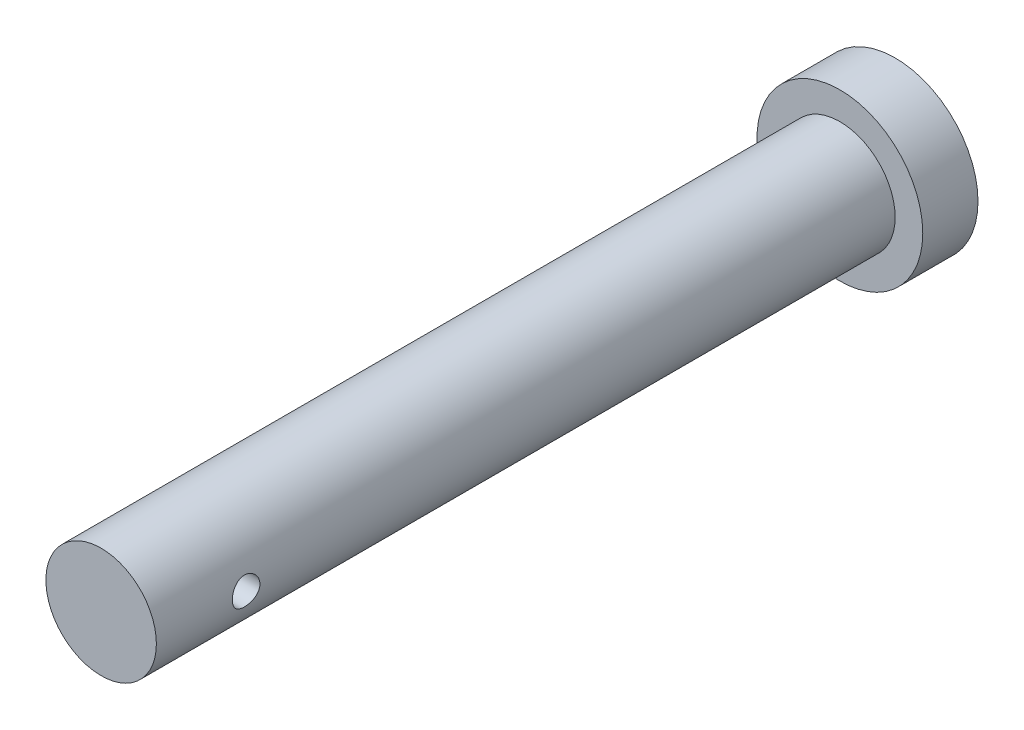
from build123d import *

# Parameters (mm, degrees)
SKETCH1_R               = 12
BOSS_EXTRUDE1_DEPTH     = 8
SKETCH1_3_R             = 8
BOSS_EXTRUDE2_DEPTH     = 115
CUT_EXTRUDE1_DEPTH      = 100
CUT_EXTRUDE1_DEPTH_BACK = 100
SKETCH3_R               = 2


with BuildPart() as part:
    # Sketch1 → Boss-Extrude1 (new body)
    with BuildSketch(Plane.XY):
        Circle(SKETCH1_R)
    extrude(amount=BOSS_EXTRUDE1_DEPTH)

    # Sketch1<3> → Boss-Extrude2 (add)
    with BuildSketch(Plane.XY):
        Circle(SKETCH1_3_R)
    extrude(amount=BOSS_EXTRUDE2_DEPTH)

    # Sketch3 → Cut-Extrude1 (cut, two sides: drawn at the far end of the back side and taken through both)
    with BuildSketch(Plane(origin=(0, 0, 0), x_dir=(0, 0, -1), z_dir=(1, 0, 0)).offset(-CUT_EXTRUDE1_DEPTH_BACK)):
        with Locations((-102, 0)):
            Circle(SKETCH3_R)
    extrude(amount=CUT_EXTRUDE1_DEPTH + CUT_EXTRUDE1_DEPTH_BACK, mode=Mode.SUBTRACT)


solid = part.part
